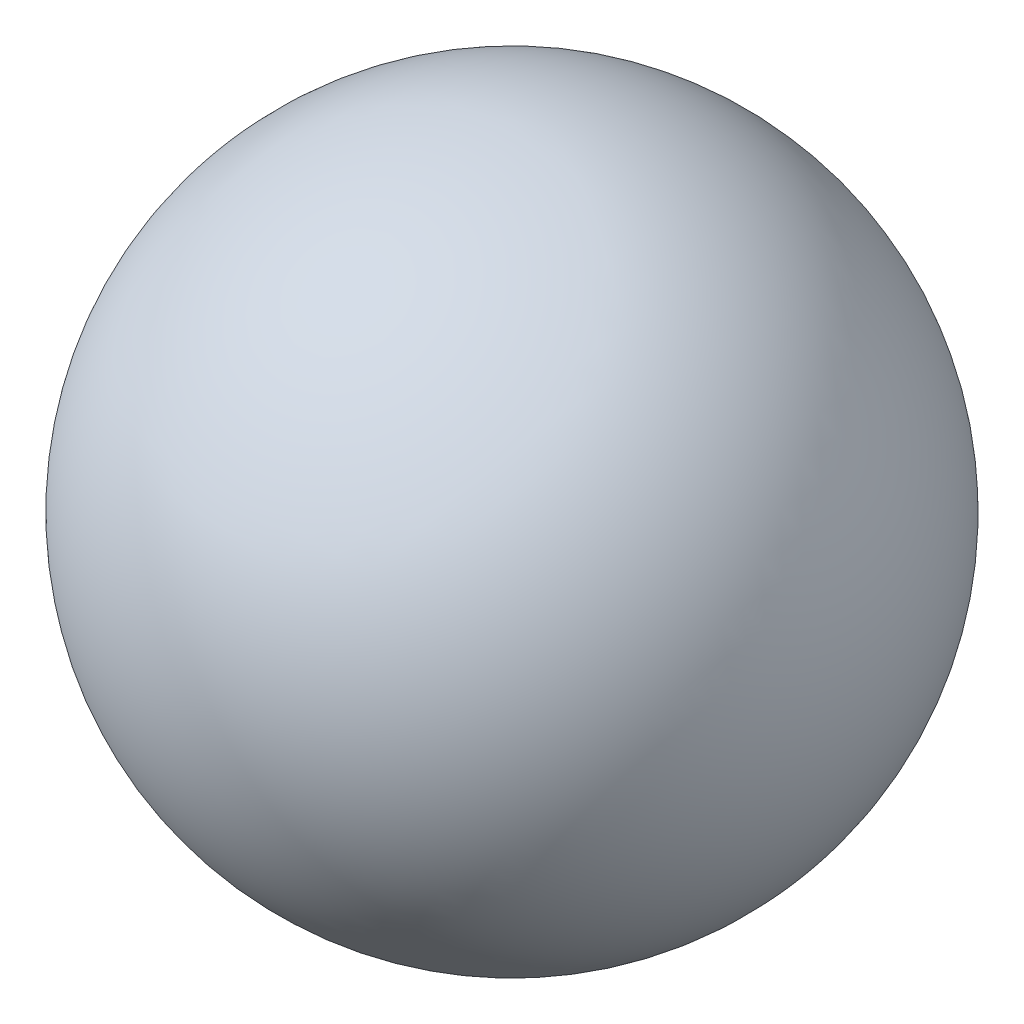
from build123d import *


with BuildPart() as part:
    # Sketch1 → Revolve1 (revolve)
    with BuildSketch(Plane(origin=(0, 0, 0), x_dir=(-1, 0, 0), z_dir=(0, 0, -1))):
        with BuildLine():
            Line((2.779932675, 1.604994878), (4.094143968, 2.363755122))
            ThreePointArc((4.094143968, 2.363755122), (3.0576582, 2.641480646), (2.779932675, 1.604994878))
        make_face()
    revolve(axis=Axis((-3.196520962, 1.845512238, 0), (-0.866025403784433, 0.5000000000000099, 0)))


solid = part.part
